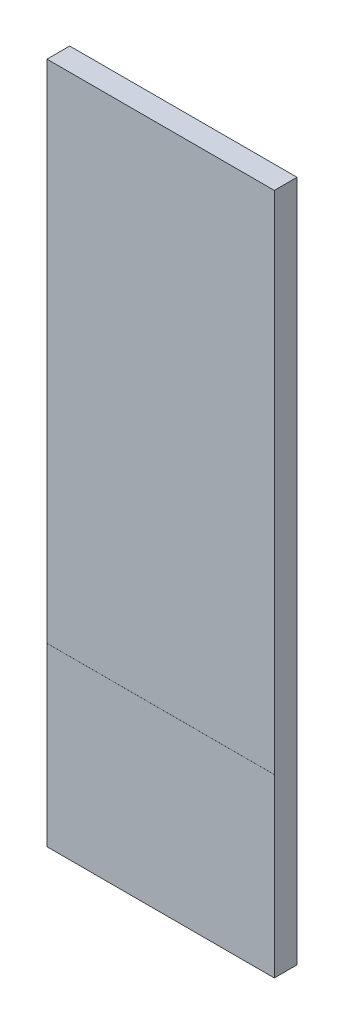
from build123d import *

# Parameters (mm, degrees)
SKETCH1_W           = 40
SKETCH1_H           = 120
BOSS_EXTRUDE1_DEPTH = 4
SKETCH4_W           = 40
SKETCH4_H           = 0.01
CUT_EXTRUDE1_DEPTH  = 0.01


with BuildPart() as part:
    # Sketch1 → Boss-Extrude1 (new body)
    with BuildSketch(Plane.XY):
        Rectangle(SKETCH1_W, SKETCH1_H)
    extrude(amount=BOSS_EXTRUDE1_DEPTH)

    # Sketch4 → Cut-Extrude1 (cut)
    with BuildSketch(Plane.XY.offset(4)):
        with Locations((0, -29.005)):
            Rectangle(SKETCH4_W, SKETCH4_H)
    extrude(amount=-CUT_EXTRUDE1_DEPTH, mode=Mode.SUBTRACT)


solid = part.part
